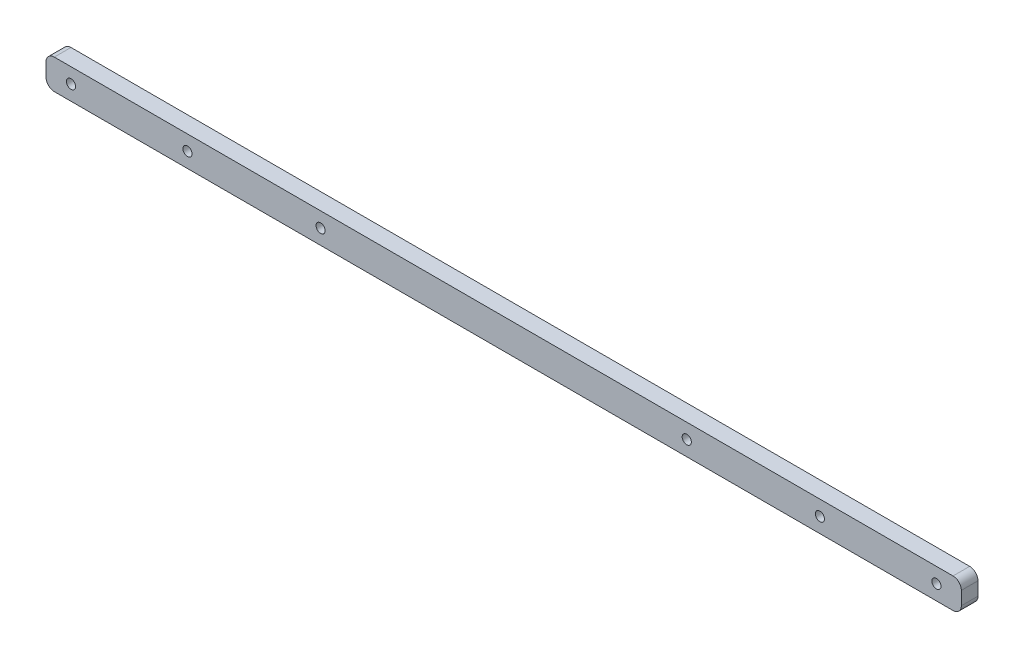
from build123d import *

# Parameters (mm, degrees)
SKETCH_1_W          = 550
SKETCH_1_H          = 18
SKETCH_1_R          = 2.75
EXTRUDE_1_DEPTH     = 10
FILLET_1_R          = 5
SKETCH_2_R          = 2.75
CUT_EXTRUDE_1_DEPTH = 10


with BuildPart() as part:
    # 草图1 → 凸台-拉伸1 (new body)
    with BuildSketch(Plane.XY):
        with Locations((275, -9)):
            Rectangle(SKETCH_1_W, SKETCH_1_H)
        with Locations((15, -9)):
            Circle(SKETCH_1_R, mode=Mode.SUBTRACT)
        with Locations((85, -9)):
            Circle(SKETCH_1_R, mode=Mode.SUBTRACT)
        with Locations(Location((465, -9, 0), (0, 0, 180))):
            Circle(SKETCH_1_R, mode=Mode.SUBTRACT)
        with Locations(Location((535, -9, 0), (0, 0, 180))):
            Circle(SKETCH_1_R, mode=Mode.SUBTRACT)
    extrude(amount=EXTRUDE_1_DEPTH)

    # 圆角1
    fillet_1_edges = [part.edges().sort_by_distance(p)[0] for p in [
        (0, 0, 5),
        (550, 0, 5),
        (550, -18, 5),
        (0, -18, 5),
    ]]
    fillet(fillet_1_edges, radius=FILLET_1_R)

    # 草图2 → 切除-拉伸1 (cut)
    with BuildSketch(Plane.XY.offset(10)):
        with Locations((385, -9)):
            Circle(SKETCH_2_R)
        with Locations(Location((165, -9, 0), (0, 0, 180))):
            Circle(SKETCH_2_R)
    extrude(amount=-CUT_EXTRUDE_1_DEPTH, mode=Mode.SUBTRACT)


solid = part.part
